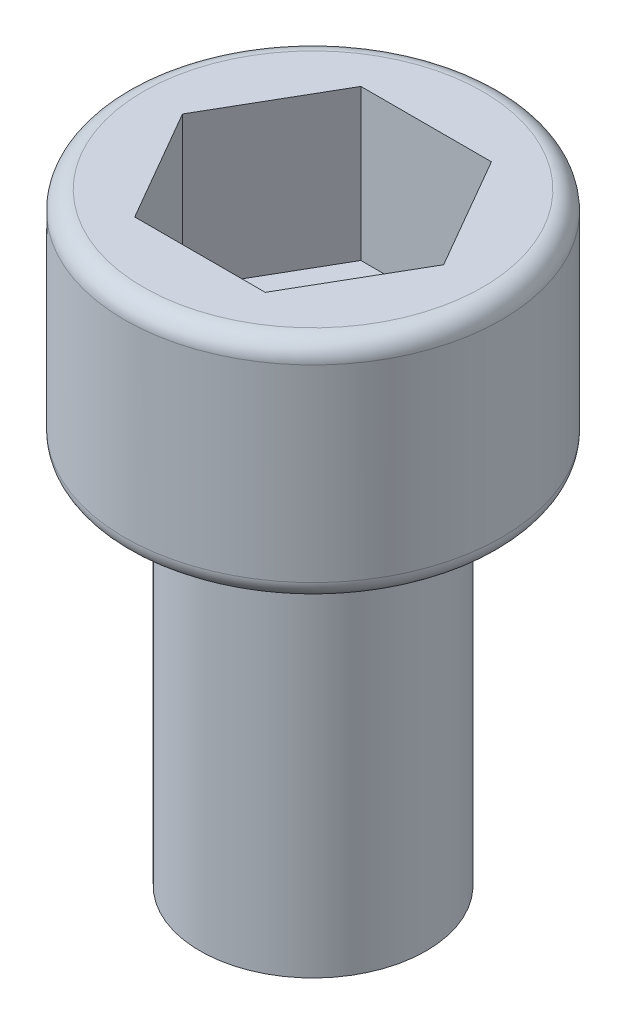
from build123d import *

# Parameters (mm, degrees)
CUT_EXTRUDE1_DEPTH = 2
FILLET1_R          = 0.25


with BuildPart() as part:
    # Sketch1 → Revolve1 (revolve)
    with BuildSketch(Plane.XY):
        Polygon((0, -4), (1.5, -4), (1.5, 1), (2.5, 1), (2.5, 4), (0, 4), align=None)
    revolve(axis=Axis((0, -1000, 0), (0, 1, 0)))

    # Sketch2 → Cut-Extrude1 (cut)
    with BuildSketch(Plane(origin=(0, 4, 0), x_dir=(1, 0, 0), z_dir=(0, 1, 0))):
        Polygon((0.866025404, 1.5), (-0.866025404, 1.5), (-1.732050808, 0), (-0.866025404, -1.5), (0.866025404, -1.5), (1.732050808, 0), align=None)
    extrude(amount=-CUT_EXTRUDE1_DEPTH, mode=Mode.SUBTRACT)

    # Fillet1
    fillet1_edges = [part.edges().sort_by_distance(p)[0] for p in [
        (-2.5, 4, 0),
        (-2.5, 1, 0),
    ]]
    fillet(fillet1_edges, radius=FILLET1_R)


solid = part.part
